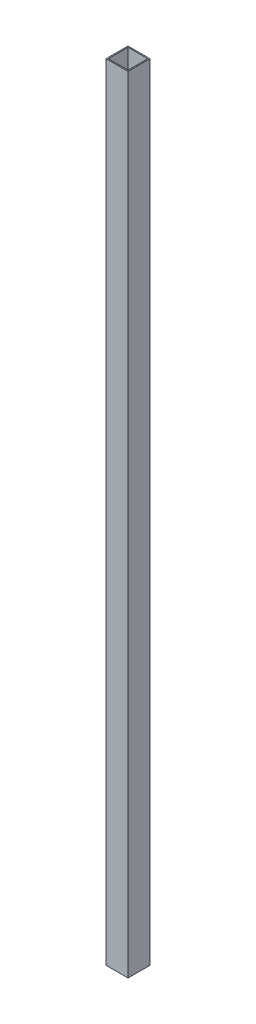
from build123d import *

# Parameters (mm, degrees)
SKETCH1_W           = 20
SKETCH1_H           = 20
SKETCH1_W_2         = 18
SKETCH1_H_2         = 18
BOSS_EXTRUDE1_DEPTH = 715.05


with BuildPart() as part:
    # Sketch1 → Boss-Extrude1 (new body)
    with BuildSketch(Plane(origin=(0, 0, 0), x_dir=(1, 0, 0), z_dir=(0, 1, 0))):
        Rectangle(SKETCH1_W, SKETCH1_H)
        Rectangle(SKETCH1_W_2, SKETCH1_H_2, mode=Mode.SUBTRACT)
    extrude(amount=BOSS_EXTRUDE1_DEPTH)


solid = part.part
